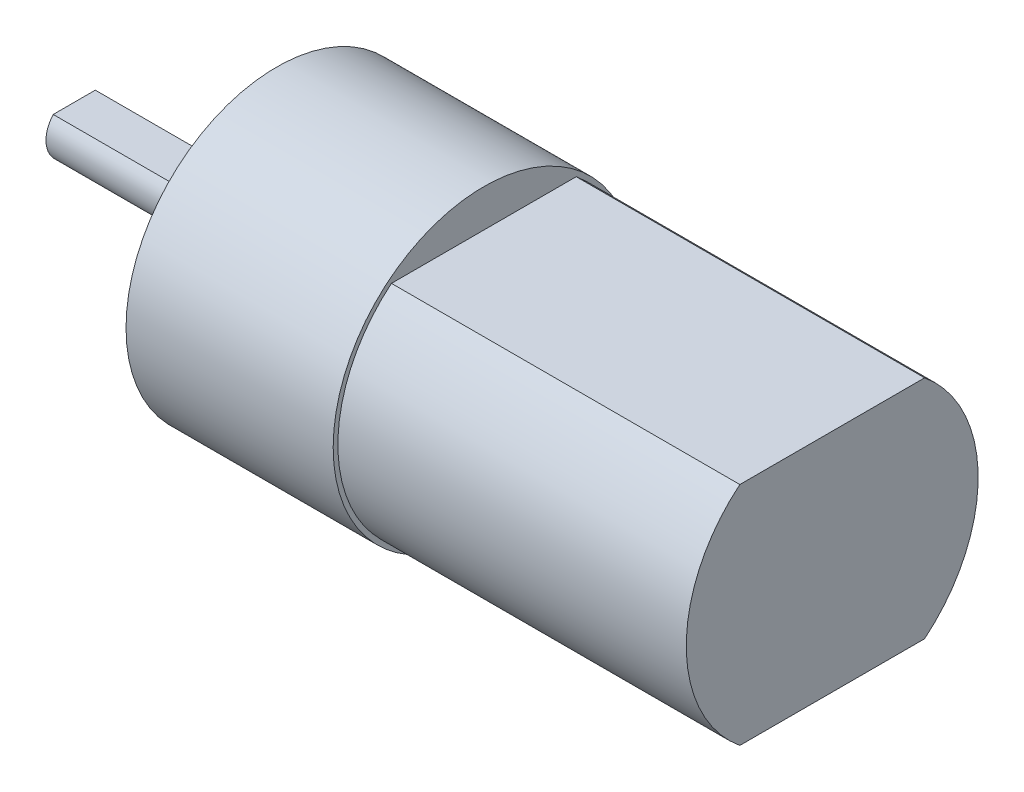
from build123d import *

# Parameters (mm, degrees)
BOSS_EXTRUDE1_DEPTH = 18.5
SKETCH3_R           = 8
BOSS_EXTRUDE2_DEPTH = 11
SKETCH4_R           = 2
BOSS_EXTRUDE3_DEPTH = 0.75
SKETCH6_R           = 1.5
BOSS_EXTRUDE4_DEPTH = 10
CUT_EXTRUDE1_DEPTH  = 10
CUT_EXTRUDE2_DEPTH  = 3


with BuildPart() as part:
    # Sketch2 → Boss-Extrude1 (new body)
    with BuildSketch(Plane(origin=(0, 0, 0), x_dir=(0, 0, -1), z_dir=(1, 0, 0))):
        with BuildLine():
            Line((0, 6), (-4.905354218, 6))
            ThreePointArc((-4.905354218, 6), (-7.75, 0), (-4.905354218, -6))
            Line((-4.905354218, -6), (0, -6))
            Line((0, -6), (0, 6))
        make_face()
        with BuildLine():
            Line((4.905354218, 6), (0, 6))
            Line((0, 6), (0, -6))
            Line((0, -6), (4.905354218, -6))
            ThreePointArc((4.905354218, -6), (7.002820688, -3.320090723), (7.75, 0))
            ThreePointArc((7.75, 0), (7.002820688, 3.320090723), (4.905354218, 6))
        make_face()
    extrude(amount=BOSS_EXTRUDE1_DEPTH)

    # Sketch3 → Boss-Extrude2 (add)
    with BuildSketch(Plane.ZY):
        Circle(SKETCH3_R)
    extrude(amount=BOSS_EXTRUDE2_DEPTH)

    # Sketch4 → Boss-Extrude3 (add)
    with BuildSketch(Plane.ZY.offset(11)):
        Circle(SKETCH4_R)
    extrude(amount=BOSS_EXTRUDE3_DEPTH)

    # Sketch6 → Boss-Extrude4 (add)
    with BuildSketch(Plane.ZY.offset(11.75)):
        Circle(SKETCH6_R)
    extrude(amount=BOSS_EXTRUDE4_DEPTH)

    # Sketch7 → Cut-Extrude1 (cut)
    with BuildSketch(Plane.ZY.offset(21.75)):
        Polygon((-36.741347109, 1), (-1.118033989, 1), (1.118033989, 1), (36.741347109, 1), (36.741347109, 72.246626241), (-36.741347109, 72.246626241), align=None)
    extrude(amount=-CUT_EXTRUDE1_DEPTH, mode=Mode.SUBTRACT)

    # Sketch8 → Cut-Extrude2 (cut)
    with BuildSketch(Plane.ZY.offset(11)):
        with BuildLine():
            ThreePointArc((-4.388888889, -0.99380799), (-3.754644008, -0.666666667), (-3.5, 0))
            Line((-3.5, 0), (-4.5, 0))
            ThreePointArc((-4.5, 0), (-4.472135955, -0.5), (-4.388888889, -0.99380799))
        make_face()
        with BuildLine():
            Line((-4.5, 0), (-3.5, 0))
            ThreePointArc((-3.5, 0), (-3.754644008, 0.666666667), (-4.388888889, 0.99380799))
            ThreePointArc((-4.388888889, 0.99380799), (-4.472135955, 0.5), (-4.5, 0))
        make_face()
        with BuildLine():
            ThreePointArc((-4.5, 0), (-4.472135955, 0.5), (-4.388888889, 0.99380799))
            ThreePointArc((-4.388888889, 0.99380799), (-5.166666667, 0.745355992), (-5.5, 0))
            Line((-5.5, 0), (-4.5, 0))
        make_face()
        with BuildLine():
            ThreePointArc((-5.5, 0), (-5.166666667, -0.745355992), (-4.388888889, -0.99380799))
            ThreePointArc((-4.388888889, -0.99380799), (-4.472135955, -0.5), (-4.5, 0))
            Line((-4.5, 0), (-5.5, 0))
        make_face()
        with BuildLine():
            ThreePointArc((4.388888889, 0.99380799), (4.472135955, 0.5), (4.5, 0))
            Line((4.5, 0), (5.5, 0))
            ThreePointArc((5.5, 0), (5.166666667, 0.745355992), (4.388888889, 0.99380799))
        make_face()
        with BuildLine():
            ThreePointArc((4.388888889, -0.99380799), (4.472135955, -0.5), (4.5, 0))
            Line((4.5, 0), (3.5, 0))
            ThreePointArc((3.5, 0), (3.754644008, -0.666666667), (4.388888889, -0.99380799))
        make_face()
        with BuildLine():
            Line((3.5, 0), (4.5, 0))
            ThreePointArc((4.5, 0), (4.472135955, 0.5), (4.388888889, 0.99380799))
            ThreePointArc((4.388888889, 0.99380799), (3.754644008, 0.666666667), (3.5, 0))
        make_face()
        with BuildLine():
            Line((5.5, 0), (4.5, 0))
            ThreePointArc((4.5, 0), (4.472135955, -0.5), (4.388888889, -0.99380799))
            ThreePointArc((4.388888889, -0.99380799), (5.166666667, -0.745355992), (5.5, 0))
        make_face()
    extrude(amount=-CUT_EXTRUDE2_DEPTH, mode=Mode.SUBTRACT)


solid = part.part
